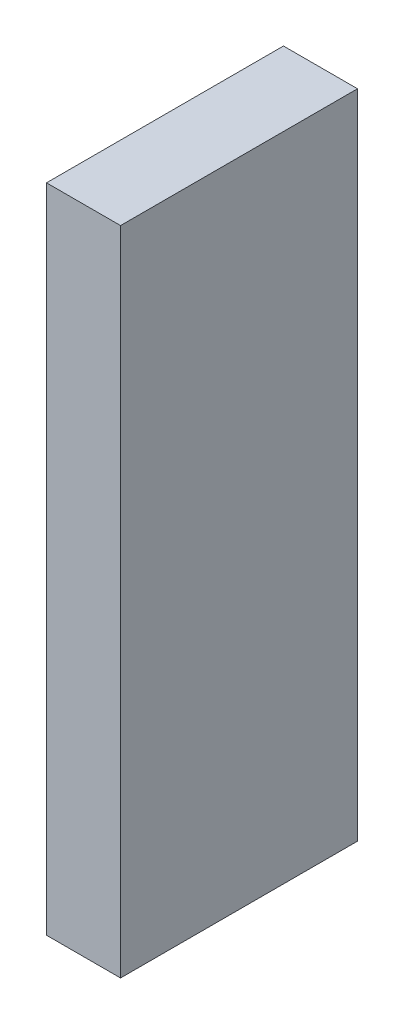
from build123d import *

# Parameters (mm, degrees)
TOPPING_EVAPORATOR_SOL_KANAL_1_START = -200
SKETCH1_W                            = 125
SKETCH1_H                            = 1100
TOPPING_EVAPORATOR_SOL_KANAL_1_DEPTH = 400


with BuildPart() as part:
    # Sketch1 → TOPPING_evaporator_sol_kanal_1 (new body)
    with BuildSketch(Plane.XY.offset(TOPPING_EVAPORATOR_SOL_KANAL_1_START)):
        with Locations((110, 950)):
            Rectangle(SKETCH1_W, SKETCH1_H)
    extrude(amount=-TOPPING_EVAPORATOR_SOL_KANAL_1_DEPTH)


solid = part.part
